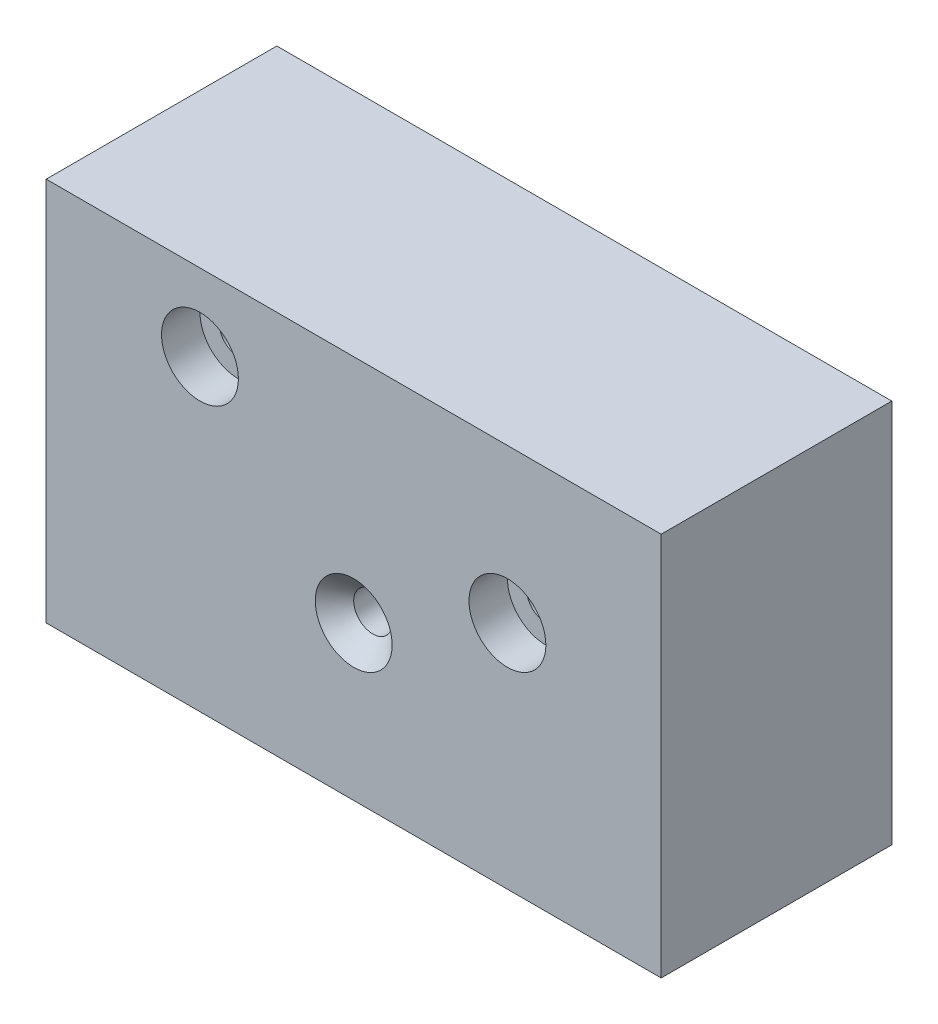
from build123d import *

# Parameters (mm, degrees)
SKETCH1_W                                        = 80
SKETCH1_H                                        = 50
BOSS_EXTRUDE1_DEPTH                              = 30
CBORE_FOR_M10_HEX_HEAD_BOLT8_D                   = 5
CBORE_FOR_M10_HEX_HEAD_BOLT8_CBORE_D             = 10
CBORE_FOR_M10_HEX_HEAD_BOLT8_CBORE_DEPTH         = 5
CBORE_FOR_M10_HEX_HEAD_BOLT9_D                   = 5
CBORE_FOR_M10_HEX_HEAD_BOLT9_CBORE_D             = 10
CBORE_FOR_M10_HEX_HEAD_BOLT9_CBORE_DEPTH         = 5
CSK_FOR_M10_FLAT_HEAD_MACHINE_SCREW1_D           = 5
CSK_FOR_M10_FLAT_HEAD_MACHINE_SCREW1_CSINK_D     = 10
CSK_FOR_M10_FLAT_HEAD_MACHINE_SCREW1_CSINK_ANGLE = 90


with BuildPart() as part:
    # Sketch1 → Boss-Extrude1 (new body)
    with BuildSketch(Plane.XY):
        with Locations((-9.393939394, -2.727272727)):
            Rectangle(SKETCH1_W, SKETCH1_H)
    extrude(amount=BOSS_EXTRUDE1_DEPTH)

    # CBORE for M10 Hex Head Bolt8 (through all)
    with Locations(Plane.XY.offset(30)):
        with Locations((-29.393939394, 12.272727273)):
            CounterBoreHole(CBORE_FOR_M10_HEX_HEAD_BOLT8_D / 2, CBORE_FOR_M10_HEX_HEAD_BOLT8_CBORE_D / 2, CBORE_FOR_M10_HEX_HEAD_BOLT8_CBORE_DEPTH)

    # CBORE for M10 Hex Head Bolt9 (through all)
    with Locations(Plane.XY.offset(30)):
        with Locations((10.606060606, 2.272727273)):
            CounterBoreHole(CBORE_FOR_M10_HEX_HEAD_BOLT9_D / 2, CBORE_FOR_M10_HEX_HEAD_BOLT9_CBORE_D / 2, CBORE_FOR_M10_HEX_HEAD_BOLT9_CBORE_DEPTH)

    # CSK for M10 Flat Head Machine Screw1 (through all)
    with Locations(Plane.XY.offset(30)):
        with Locations((-9.393939394, -7.727272727)):
            CounterSinkHole(CSK_FOR_M10_FLAT_HEAD_MACHINE_SCREW1_D / 2, CSK_FOR_M10_FLAT_HEAD_MACHINE_SCREW1_CSINK_D / 2, counter_sink_angle=CSK_FOR_M10_FLAT_HEAD_MACHINE_SCREW1_CSINK_ANGLE)


solid = part.part
